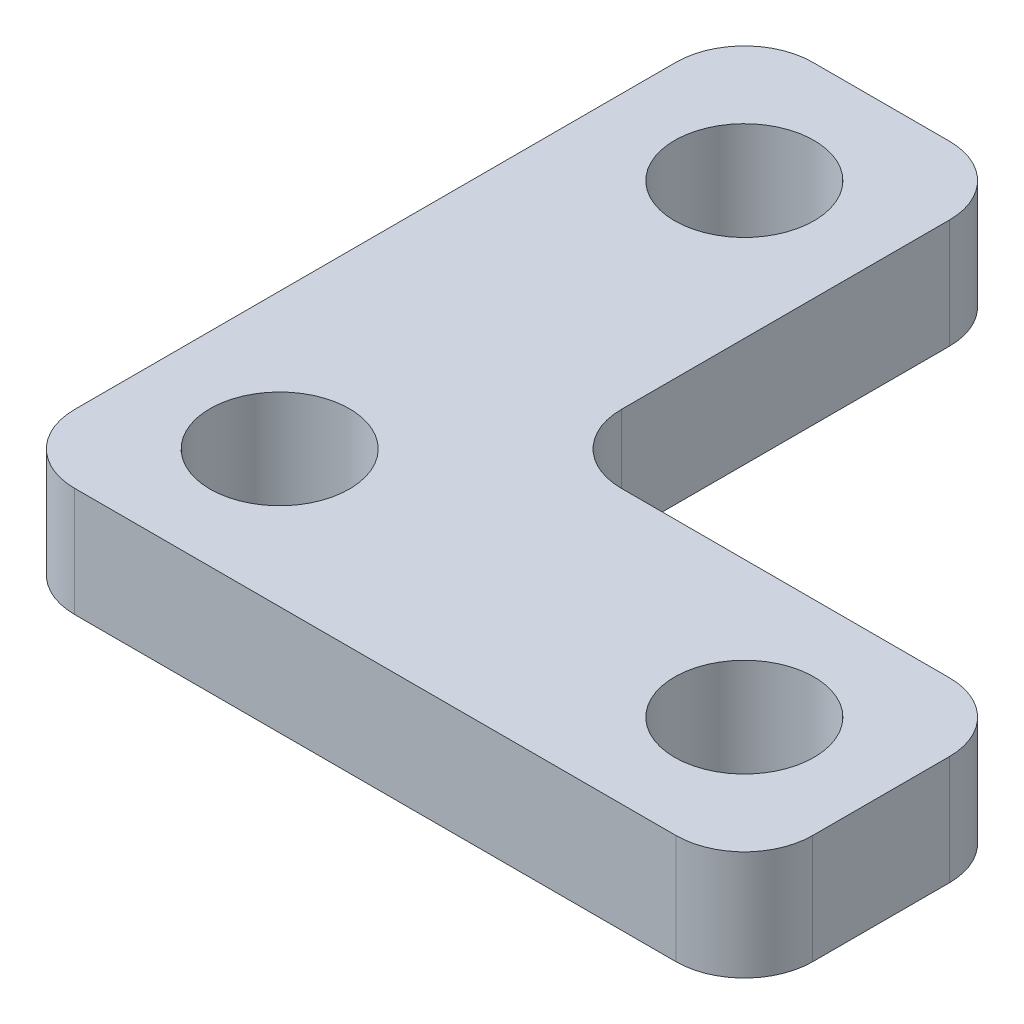
from build123d import *

# Parameters (mm, degrees)
SKETCH1_R           = 2.55
BOSS_EXTRUDE1_DEPTH = 4


with BuildPart() as part:
    # Sketch1 → Boss-Extrude1 (new body)
    with BuildSketch(Plane(origin=(0, 0, 0), x_dir=(1, 0, 0), z_dir=(0, 1, 0))):
        with BuildLine():
            Line((0, 2.5), (0, 24.5))
            ThreePointArc((0, 24.5), (0.732233047, 26.267766953), (2.5, 27))
            Line((2.5, 27), (7.5, 27))
            ThreePointArc((7.5, 27), (9.267766953, 26.267766953), (10, 24.5))
            Line((10, 24.5), (10, 12.5))
            ThreePointArc((10, 12.5), (10.732233047, 10.732233047), (12.5, 10))
            Line((12.5, 10), (24.5, 10))
            ThreePointArc((24.5, 10), (26.267766953, 9.267766953), (27, 7.5))
            Line((27, 7.5), (27, 2.5))
            ThreePointArc((27, 2.5), (26.267766953, 0.732233047), (24.5, 0))
            Line((24.5, 0), (2.5, 0))
            ThreePointArc((2.5, 0), (0.732233047, 0.732233047), (0, 2.5))
        make_face()
        with Locations(Location((22, 5, 0), (0, 0, 270))):
            Circle(SKETCH1_R, mode=Mode.SUBTRACT)
        with Locations(Location((5, 5, 0), (0, 0, 270))):
            Circle(SKETCH1_R, mode=Mode.SUBTRACT)
        with Locations(Location((5, 22, 0), (0, 0, 270))):
            Circle(SKETCH1_R, mode=Mode.SUBTRACT)
    extrude(amount=BOSS_EXTRUDE1_DEPTH)


solid = part.part
